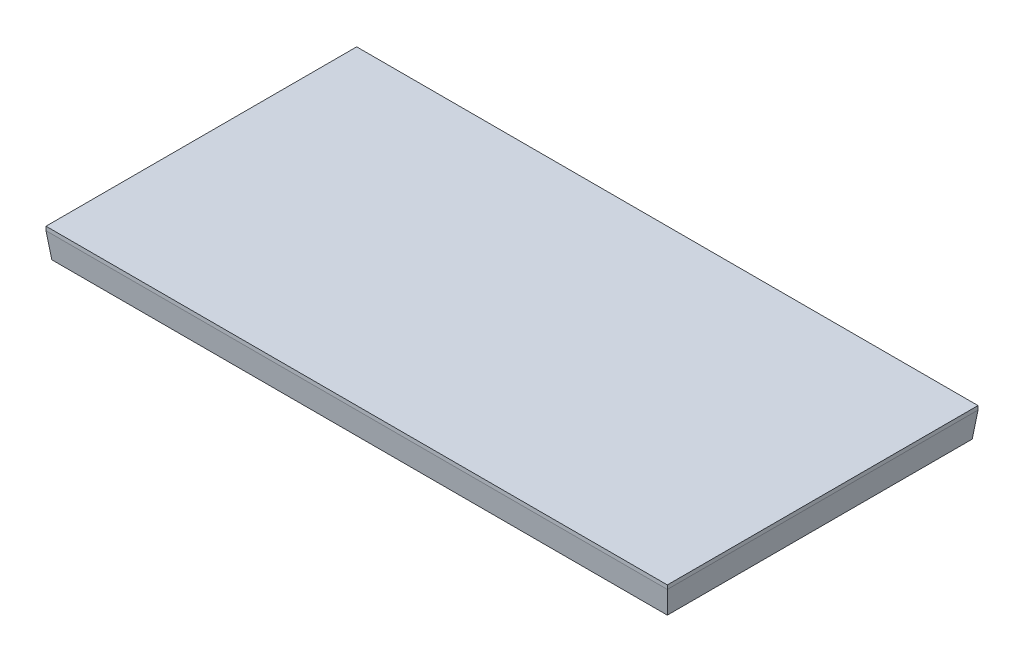
from build123d import *

# Parameters (mm, degrees)
SKETCH2_W                                  = 320
SKETCH2_H                                  = 160
BOSS_EXTRUDE1_DEPTH                        = 2
SKETCH3_R                                  = 1.6
CUT_EXTRUDE1_DEPTH                         = 7
CUT_EXTRUDE2_DEPTH                         = 12.5
MIRROR1_AT_THE_SECOND_PLANE_COPY_1_SKETC_R = 1.6
MIRROR1_AT_THE_SECOND_PLANE_COPY_1_DEPTH   = 7
MIRROR1_AT_THE_SECOND_PLANE_COPY_2_DEPTH   = 12.5
SKETCH4_W                                  = 8.5
SKETCH4_H                                  = 28
SKETCH4_W_2                                = 16
SKETCH4_H_2                                = 8
BOSS_EXTRUDE3_DEPTH                        = 10
SKETCH5_R                                  = 1.5
BOSS_EXTRUDE4_DEPTH                        = 2


with BuildPart() as part:
    # Sketch2 → Boss-Extrude1 (new body)
    with BuildSketch(Plane(origin=(0, 13, 0), x_dir=(1, 0, 0), z_dir=(0, 1, 0))):
        Rectangle(SKETCH2_W, SKETCH2_H)
    extrude(amount=BOSS_EXTRUDE1_DEPTH)

    # Sketch1 → Loft1 section 0
    with BuildSketch(Plane(origin=(0, 0, 0), x_dir=(1, 0, 0), z_dir=(0, 1, 0))):
        with BuildLine():
            Line((-158.5, -78.5), (158.5, -78.5))
            Line((158.5, -78.5), (158.5, 78.5))
            Line((158.5, 78.5), (-158.5, 78.5))
            Line((-158.5, 78.5), (-158.5, -78.5))
        make_face()
    # Sketch2<2> → Loft1 section 1
    with BuildSketch(Plane(origin=(0, 13, 0), x_dir=(1, 0, 0), z_dir=(0, 1, 0))):
        with BuildLine():
            Line((160, -80), (-160, -80))
            Line((-160, -80), (-160, 80))
            Line((-160, 80), (160, 80))
            Line((160, 80), (160, -80))
        make_face()
    loft()

    # Sketch3 → Cut-Extrude1 (cut)
    with BuildSketch(Plane.XZ):
        with Locations((0, 72)):
            Circle(SKETCH3_R)
        with Locations((-152, 72)):
            Circle(SKETCH3_R)
    cut_extrude1 = extrude(amount=-CUT_EXTRUDE1_DEPTH, mode=Mode.SUBTRACT)

    # Sketch3<4> → Cut-Extrude2 (cut)
    with BuildSketch(Plane.XZ):
        with BuildLine():
            Line((-85, 0), (-85, 19.75))
            Line((-85, 19.75), (-88, 22.75))
            Line((-88, 22.75), (-88, 63.4))
            ThreePointArc((-88, 63.4), (-89.318019485, 66.581980515), (-92.5, 67.9))
            Line((-92.5, 67.9), (-141.5, 67.9))
            ThreePointArc((-141.5, 67.9), (-144.681980515, 66.581980515), (-146, 63.4))
            Line((-146, 63.4), (-146, 22.75))
            Line((-146, 22.75), (-149, 19.75))
            Line((-149, 19.75), (-149, 0))
            Line((-149, 0), (-85, 0))
        make_face()
        with BuildLine():
            Line((-71, 0), (-7, 0))
            Line((-7, 0), (-7, 19.75))
            Line((-7, 19.75), (-10, 22.75))
            Line((-10, 22.75), (-10, 63.4))
            ThreePointArc((-10, 63.4), (-11.318019485, 66.581980515), (-14.5, 67.9))
            Line((-14.5, 67.9), (-63.5, 67.9))
            ThreePointArc((-63.5, 67.9), (-66.681980515, 66.581980515), (-68, 63.4))
            Line((-68, 63.4), (-68, 22.75))
            Line((-68, 22.75), (-71, 19.75))
            Line((-71, 19.75), (-71, 0))
        make_face()
    cut_extrude2 = extrude(amount=-CUT_EXTRUDE2_DEPTH, mode=Mode.SUBTRACT)

    # Mirror1: Cut-Extrude1, Cut-Extrude2 across plane
    add(cut_extrude1.mirror(Plane.XY), mode=Mode.SUBTRACT)
    add(cut_extrude2.mirror(Plane.XY), mode=Mode.SUBTRACT)

    # Mirror1 at the second plane: Cut-Extrude1, Cut-Extrude2 across plane
    add(cut_extrude1.mirror(Plane(origin=(0, 0, 0), x_dir=(0, 0, 1), z_dir=(1, 0, 0))), mode=Mode.SUBTRACT)
    add(cut_extrude2.mirror(Plane(origin=(0, 0, 0), x_dir=(0, 0, 1), z_dir=(1, 0, 0))), mode=Mode.SUBTRACT)

    # Mirror1 at the second plane copy 1 sketc → Mirror1 at the second plane copy 1 (cut)
    with BuildSketch(Plane(origin=(0, 0, 0), x_dir=(-1, 0, 0), z_dir=(0, -1, 0))):
        with Locations((0, 72)):
            Circle(MIRROR1_AT_THE_SECOND_PLANE_COPY_1_SKETC_R)
        with Locations((-152, 72)):
            Circle(MIRROR1_AT_THE_SECOND_PLANE_COPY_1_SKETC_R)
    extrude(amount=-MIRROR1_AT_THE_SECOND_PLANE_COPY_1_DEPTH, mode=Mode.SUBTRACT)

    # Mirror1 at the second plane copy 2 sketc → Mirror1 at the second plane copy 2 (cut)
    with BuildSketch(Plane(origin=(0, 0, 0), x_dir=(-1, 0, 0), z_dir=(0, -1, 0))):
        with BuildLine():
            Line((-85, 0), (-85, 19.75))
            Line((-85, 19.75), (-88, 22.75))
            Line((-88, 22.75), (-88, 63.4))
            ThreePointArc((-88, 63.4), (-89.318019485, 66.581980515), (-92.5, 67.9))
            Line((-92.5, 67.9), (-141.5, 67.9))
            ThreePointArc((-141.5, 67.9), (-144.681980515, 66.581980515), (-146, 63.4))
            Line((-146, 63.4), (-146, 22.75))
            Line((-146, 22.75), (-149, 19.75))
            Line((-149, 19.75), (-149, 0))
            Line((-149, 0), (-85, 0))
        make_face()
        with BuildLine():
            Line((-71, 0), (-7, 0))
            Line((-7, 0), (-7, 19.75))
            Line((-7, 19.75), (-10, 22.75))
            Line((-10, 22.75), (-10, 63.4))
            ThreePointArc((-10, 63.4), (-11.318019485, 66.581980515), (-14.5, 67.9))
            Line((-14.5, 67.9), (-63.5, 67.9))
            ThreePointArc((-63.5, 67.9), (-66.681980515, 66.581980515), (-68, 63.4))
            Line((-68, 63.4), (-68, 22.75))
            Line((-68, 22.75), (-71, 19.75))
            Line((-71, 19.75), (-71, 0))
        make_face()
    extrude(amount=-MIRROR1_AT_THE_SECOND_PLANE_COPY_2_DEPTH, mode=Mode.SUBTRACT)

    # Sketch4 → Boss-Extrude3 (add)
    with BuildSketch(Plane.XZ.offset(-12.5)):
        with Locations((-111.25, 0)):
            Rectangle(SKETCH4_W, SKETCH4_H)
        with Locations((111.25, 0)):
            Rectangle(SKETCH4_W, SKETCH4_H)
        with Locations((31, 13)):
            Rectangle(SKETCH4_W_2, SKETCH4_H_2)
    extrude(amount=BOSS_EXTRUDE3_DEPTH)

    # Sketch5 → Boss-Extrude4 (add)
    with BuildSketch(Plane.XZ):
        with Locations((-110, 75)):
            Circle(SKETCH5_R)
        with Locations((110, -75)):
            Circle(SKETCH5_R)
    extrude(amount=BOSS_EXTRUDE4_DEPTH)


solid = part.part
